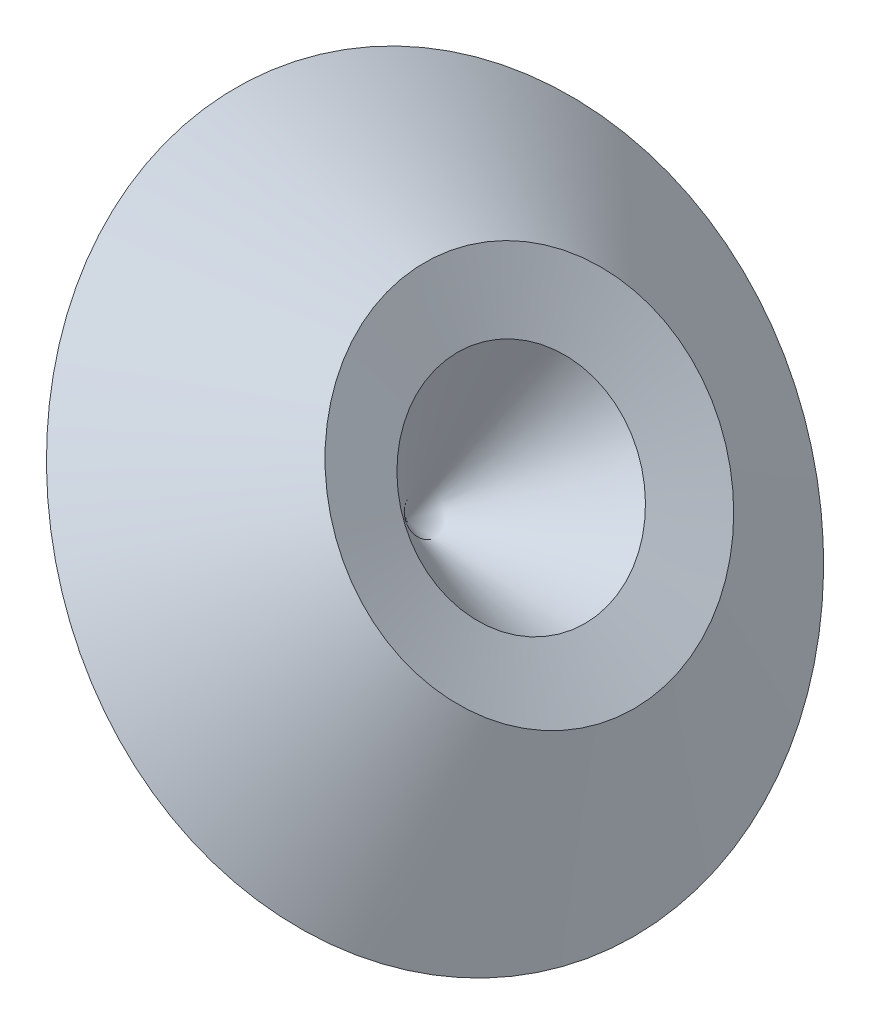
from build123d import *


with BuildPart() as part:
    # Sketch1 → Revolve1 (revolve)
    with BuildSketch(Plane.XY):
        Polygon((0, 0), (38.954118495, 28.916860969), (94.580118495, 28.916860969), (109.846553901, 13.650425563), (109.846553901, -47.563574437), (95.227012024, -47.563574437), (95.227012024, -17.083574437), (63.920327835, -11.366603955), (52.4256, -22.86133179), (52.4256, -34.29), (0, -34.29), align=None)
    revolve(axis=Axis((0, 0, 0), (0.8029459227225657, 0.5960518812848489, 0)))


solid = part.part
